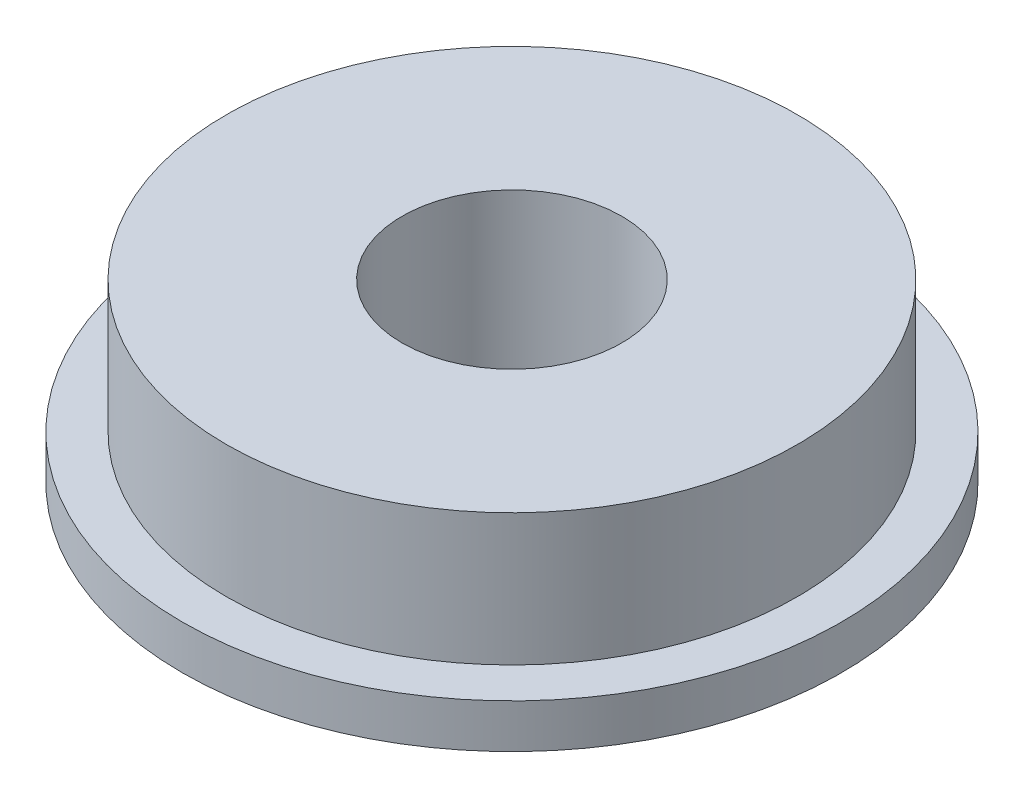
from build123d import *

# Parameters (mm, degrees)
SKETCH1_R           = 7.5
SKETCH1_R_2         = 6.5
SKETCH1_R_3         = 2.5
BOSS_EXTRUDE1_DEPTH = 1
BOSS_EXTRUDE2_START = 1
SKETCH1_3_R         = 6.5
SKETCH1_3_R_2       = 2.5
BOSS_EXTRUDE2_DEPTH = 3


with BuildPart() as part:
    # Sketch1 → Boss-Extrude1 (new body)
    # profile 1 of 2: a face of its own
    with BuildSketch(Plane(origin=(0, 0, 0), x_dir=(1, 0, 0), z_dir=(0, 1, 0))):
        with Locations(Location((0, 0, 0), (0, 0, 270))):
            Circle(SKETCH1_R)
        Circle(SKETCH1_R_2, mode=Mode.SUBTRACT)
    # profile 2 of 2: a face of its own
    with BuildSketch(Plane(origin=(0, 0, 0), x_dir=(1, 0, 0), z_dir=(0, 1, 0))):
        Circle(SKETCH1_R_2)
        with Locations(Location((0, 0, 0), (0, 0, 270))):
            Circle(SKETCH1_R_3, mode=Mode.SUBTRACT)
    extrude(amount=BOSS_EXTRUDE1_DEPTH)

    # Sketch1<3> → Boss-Extrude2 (add)
    with BuildSketch(Plane(origin=(0, 0, 0), x_dir=(1, 0, 0), z_dir=(0, 1, 0)).offset(BOSS_EXTRUDE2_START)):
        with Locations(Location((0, 0, 0), (0, 0, 270))):
            Circle(SKETCH1_3_R)
        with Locations(Location((0, 0, 0), (0, 0, 270))):
            Circle(SKETCH1_3_R_2, mode=Mode.SUBTRACT)
    extrude(amount=BOSS_EXTRUDE2_DEPTH)


solid = part.part
